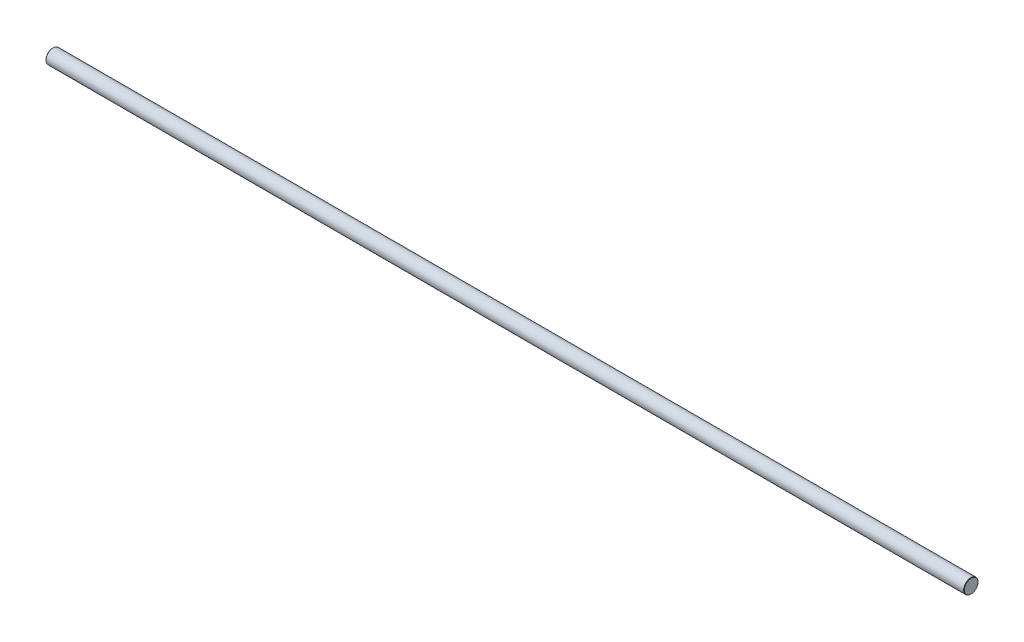
from build123d import *

# Parameters (mm, degrees)
BOSS_EXTRUDE1_DEPTH      = 304.8
BOSS_EXTRUDE1_DEPTH_BACK = 304.8
SKETCH4_R                = 4.7625
CHAMFER1_SIZE            = 0.24765


with BuildPart() as part:
    # Sketch4 → Boss-Extrude1 (new, two sides: drawn at the far end of the back side and taken through both)
    with BuildSketch(Plane(origin=(0, 0, 0), x_dir=(0, 0, -1), z_dir=(1, 0, 0)).offset(-BOSS_EXTRUDE1_DEPTH_BACK)):
        with Locations(Location((0, 0, 0), (0, 0, 180))):
            Circle(SKETCH4_R)
    extrude(amount=BOSS_EXTRUDE1_DEPTH + BOSS_EXTRUDE1_DEPTH_BACK)

    # Chamfer1
    chamfer1_edges = [part.edges().sort_by_distance(p)[0] for p in [
        (-304.8, 0, -4.7625),
        (304.8, 0, -4.7625),
    ]]
    chamfer(chamfer1_edges, length=CHAMFER1_SIZE)


solid = part.part
